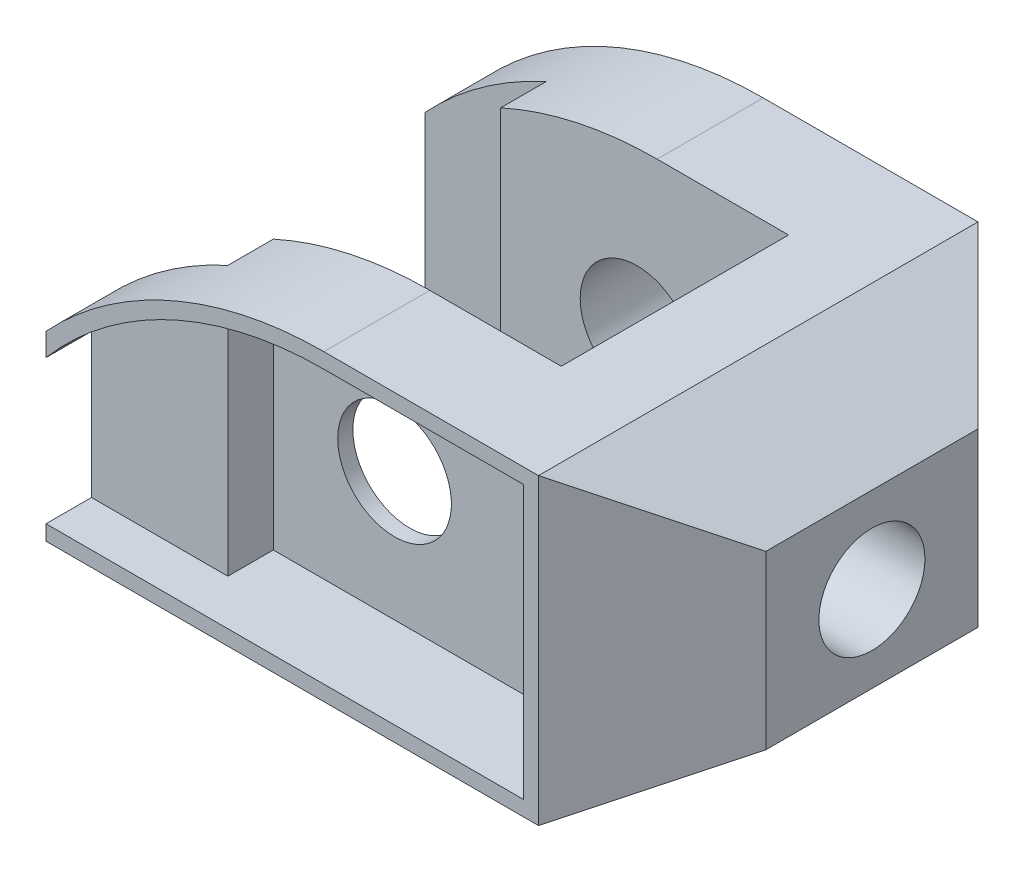
from build123d import *

# Parameters (mm, degrees)
SKETCH1_R           = 7.5
BOSS_EXTRUDE1_DEPTH = 29
CUT_EXTRUDE1_DEPTH  = 58
CUT_EXTRUDE2_DEPTH  = 58
SKETCH5_R           = 7
CUT_EXTRUDE3_DEPTH  = 58
CUT_EXTRUDE6_DEPTH  = 6
CUT_EXTRUDE8_DEPTH  = 6


with BuildPart() as part:
    # Sketch1 → Boss-Extrude1 (new, symmetric)
    with BuildSketch(Plane.XY):
        with BuildLine():
            Line((0, 0), (0, 24))
            ThreePointArc((0, 24), (16.66060556, 35.82575695), (36.66060556, 40))
            Line((36.66060556, 40), (65, 40))
            Line((65, 40), (80, 31.339745962))
            Line((80, 31.339745962), (80, 8.660254038))
            Line((80, 8.660254038), (65, 0))
            Line((65, 0), (0, 0))
        make_face()
        with Locations(Location((34, 19, 0), (0, 0, 180))):
            Circle(SKETCH1_R, mode=Mode.SUBTRACT)
    extrude(amount=BOSS_EXTRUDE1_DEPTH, both=True)

    # Sketch2 → Cut-Extrude1 (cut)
    with BuildSketch(Plane(origin=(0, 40, 0), x_dir=(1, 0, 0), z_dir=(0, 1, 0))):
        Polygon((0, 21), (16, 21), (16, 15), (54, 15), (54, -15), (16, -15), (16, -21), (0, -21), align=None)
    extrude(amount=-CUT_EXTRUDE1_DEPTH, mode=Mode.SUBTRACT)

    # Sketch4 → Cut-Extrude2 (cut)
    with BuildSketch(Plane(origin=(0, 0, 0), x_dir=(1, 0, 0), z_dir=(0, 1, 0))):
        Polygon((65, 29), (80, 29), (80, 14), align=None)
        Polygon((65, -29), (80, -29), (80, -14), align=None)
    extrude(amount=CUT_EXTRUDE2_DEPTH, mode=Mode.SUBTRACT)

    # Sketch5 → Cut-Extrude3 (cut)
    with BuildSketch(Plane(origin=(80, 0, 0), x_dir=(0, 0, -1), z_dir=(1, 0, 0))):
        with Locations((0, 20)):
            Circle(SKETCH5_R)
    extrude(amount=-CUT_EXTRUDE3_DEPTH, mode=Mode.SUBTRACT)

    # Sketch7 → Cut-Extrude6 (cut)
    with BuildSketch(Plane.XY.offset(29)):
        with BuildLine():
            Line((0, 2), (63, 2))
            Line((63, 2), (63, 38))
            Line((63, 38), (36.66060556, 38))
            ThreePointArc((36.66060556, 38), (16.452013389, 33.538635744), (0, 20.98386677))
            Line((0, 20.98386677), (0, 2))
        make_face()
    extrude(amount=-CUT_EXTRUDE6_DEPTH, mode=Mode.SUBTRACT)

    # Sketch8 → Cut-Extrude8 (cut)
    with BuildSketch(Plane.XY.offset(23)):
        with BuildLine():
            Line((18, 2), (18, 34.224221872))
            ThreePointArc((18, 34.224221872), (27.141221384, 37.046586751), (36.66060556, 38))
            Line((36.66060556, 38), (63, 38))
            Line((63, 38), (63, 2))
            Line((63, 2), (18, 2))
        make_face()
    extrude(amount=-CUT_EXTRUDE8_DEPTH, mode=Mode.SUBTRACT)


solid = part.part
